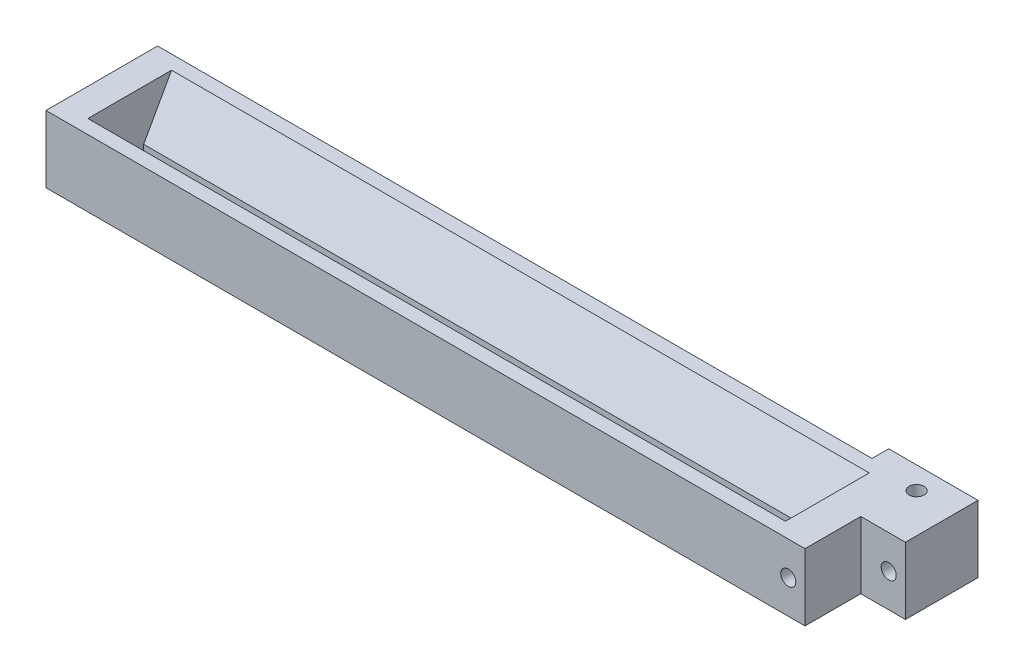
from build123d import *

# Parameters (mm, degrees)
SKETCH_1_W           = 135
SKETCH_1_H           = 20
EXTRUDE_3_DEPTH      = 12
CUT_EXTRUDE_1_DEPTH  = 62.5
SKETCH_16_R          = 1.35
EXTRUDE_4_DEPTH      = 12
SKETCH_17_R          = 1.35
CUT_EXTRUDE_12_DEPTH = 81.779019553


with BuildPart() as part:
    # 草图1 → 凸台-拉伸3 (new body)
    with BuildSketch(Plane(origin=(0, 0, 0), x_dir=(1, 0, 0), z_dir=(0, 1, 0))):
        Rectangle(SKETCH_1_W, SKETCH_1_H)
    extrude(amount=EXTRUDE_3_DEPTH)

    # 草图2 → 切除-拉伸1 (cut, symmetric)
    with BuildSketch(Plane(origin=(0, 0, 0), x_dir=(0, 0, -1), z_dir=(1, 0, 0))):
        Polygon((-7.5, 12), (-2.5, 3), (-2.5, 0), (2.5, 0), (2.5, 3), (7.5, 12), align=None)
    extrude(amount=CUT_EXTRUDE_1_DEPTH, both=True, mode=Mode.SUBTRACT)

    # 草图16 → 凸台-拉伸4 (add)
    with BuildSketch(Plane(origin=(0, 12, 0), x_dir=(1, 0, 0), z_dir=(0, 1, 0))):
        Polygon((60.5, 10), (67.5, 10), (67.5, -10), (68.5, -10), (68.5, 0), (76.5, 0), (76.5, 13), (60.5, 13), align=None)
        with Locations(Location((69.5, 9, 0), (0, 0, 270))):
            Circle(SKETCH_16_R, mode=Mode.SUBTRACT)
    extrude(amount=-EXTRUDE_4_DEPTH)

    # 草图17 → 切除-拉伸12 (cut, through all)
    with BuildSketch(Plane(origin=(0, 0, -13), x_dir=(-1, 0, 0), z_dir=(0, 0, -1))):
        with Locations((-65.5, 6)):
            Circle(SKETCH_17_R)
        with Locations((-73.5, 6)):
            Circle(SKETCH_17_R)
    extrude(amount=-CUT_EXTRUDE_12_DEPTH, mode=Mode.SUBTRACT)


solid = part.part
